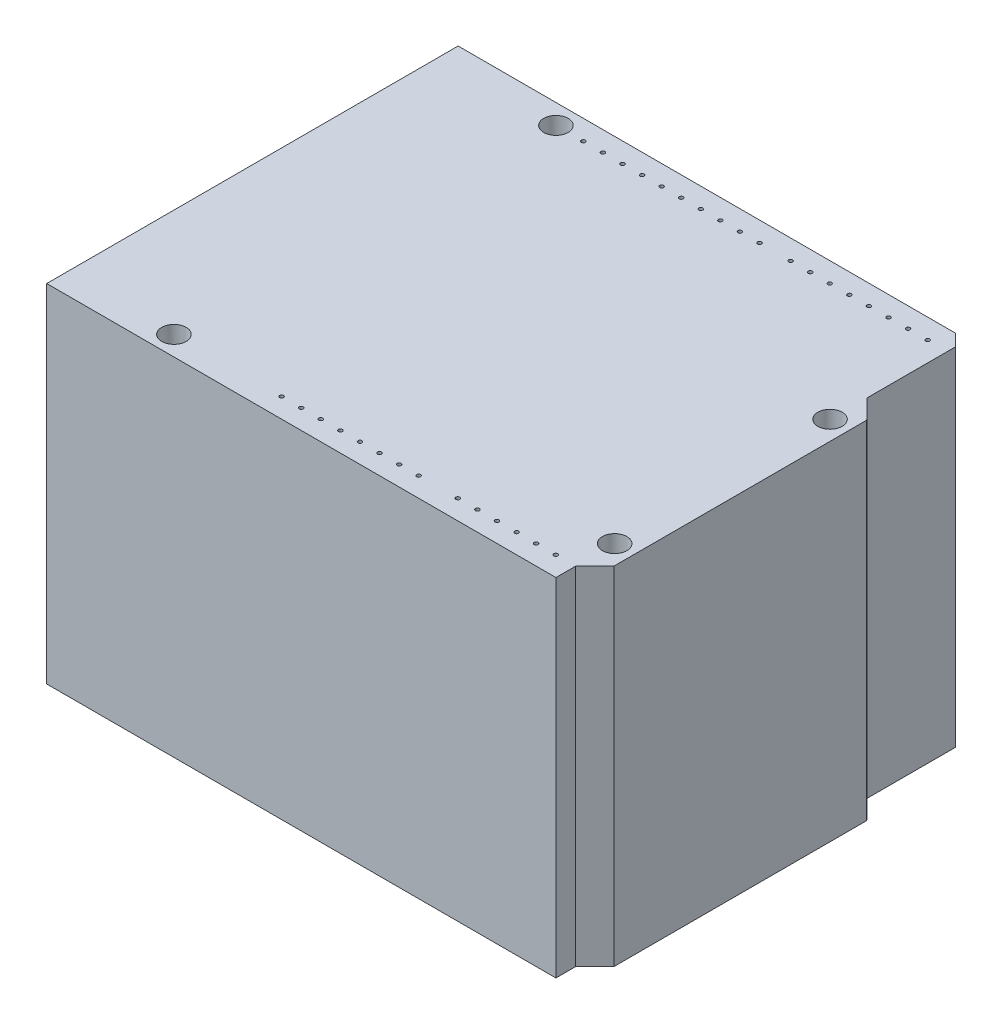
from build123d import *

# Parameters (mm, degrees)
SALIENTE_EXTRUIR1_DEPTH = 45
DRILLS_R                = 1.5875
CORTAR_EXTRUIR1_DEPTH   = 98.843568471
PINOUT_R                = 0.254
CORTAR_EXTRUIR2_DEPTH   = 98.843568471


with BuildPart() as part:
    # Board → Saliente-Extruir1 (new body)
    with BuildSketch(Plane(origin=(0, 0, 0), x_dir=(1, 0, 0), z_dir=(0, 1, 0))):
        Polygon((68.55, 37.846), (68.55, 5.08), (66.07, 2.54), (66.07, 0), (0, 0), (0, 53.378473106), (64.505207648, 53.378473106), (66.07, 51.813680753), (66.07, 40.386), align=None)
    extrude(amount=SALIENTE_EXTRUIR1_DEPTH)

    # Drills → Cortar-Extruir1 (cut, through all)
    with BuildSketch(Plane(origin=(0, 0, 0), x_dir=(1, 0, 0), z_dir=(0, 1, 0))):
        with Locations(Location((15.27, 50.8, 0), (0, 0, 90))):
            Circle(DRILLS_R)
        with Locations(Location((66.07, 35.56, 0), (0, 0, 90))):
            Circle(DRILLS_R)
        with Locations(Location((66.07, 7.62, 0), (0, 0, 90))):
            Circle(DRILLS_R)
        with Locations(Location((13.970000009, 2.54, 0), (0, 0, 90))):
            Circle(DRILLS_R)
    extrude(amount=CORTAR_EXTRUIR1_DEPTH, mode=Mode.SUBTRACT)

    # Pinout → Cortar-Extruir2 (cut, through all)
    with BuildSketch(Plane(origin=(0, 0, 0), x_dir=(1, 0, 0), z_dir=(0, 1, 0))):
        with Locations(Location((63.50000008, 2.54, 0), (0, 0, 270))):
            Circle(PINOUT_R)
        with Locations(Location((60.96000008, 2.54, 0), (0, 0, 270))):
            Circle(PINOUT_R)
        with Locations(Location((58.42000008, 2.54, 0), (0, 0, 270))):
            Circle(PINOUT_R)
        with Locations(Location((55.88000008, 2.54, 0), (0, 0, 270))):
            Circle(PINOUT_R)
        with Locations(Location((53.34000008, 2.54, 0), (0, 0, 270))):
            Circle(PINOUT_R)
        with Locations(Location((50.80000008, 2.54, 0), (0, 0, 270))):
            Circle(PINOUT_R)
        with Locations(Location((45.72000008, 2.54, 0), (0, 0, 270))):
            Circle(PINOUT_R)
        with Locations(Location((43.18000008, 2.54, 0), (0, 0, 270))):
            Circle(PINOUT_R)
        with Locations(Location((40.64000008, 2.54, 0), (0, 0, 270))):
            Circle(PINOUT_R)
        with Locations(Location((38.10000008, 2.54, 0), (0, 0, 270))):
            Circle(PINOUT_R)
        with Locations(Location((35.56000008, 2.54, 0), (0, 0, 270))):
            Circle(PINOUT_R)
        with Locations(Location((33.02000008, 2.54, 0), (0, 0, 270))):
            Circle(PINOUT_R)
        with Locations(Location((30.48000008, 2.54, 0), (0, 0, 270))):
            Circle(PINOUT_R)
        with Locations(Location((27.94000008, 2.54, 0), (0, 0, 270))):
            Circle(PINOUT_R)
        with Locations(Location((63.50000008, 50.8, 0), (0, 0, 270))):
            Circle(PINOUT_R)
        with Locations(Location((60.96000008, 50.8, 0), (0, 0, 270))):
            Circle(PINOUT_R)
        with Locations(Location((58.42000008, 50.8, 0), (0, 0, 270))):
            Circle(PINOUT_R)
        with Locations(Location((55.88000008, 50.8, 0), (0, 0, 270))):
            Circle(PINOUT_R)
        with Locations(Location((53.34000008, 50.8, 0), (0, 0, 270))):
            Circle(PINOUT_R)
        with Locations(Location((50.80000008, 50.8, 0), (0, 0, 270))):
            Circle(PINOUT_R)
        with Locations(Location((48.26000008, 50.8, 0), (0, 0, 270))):
            Circle(PINOUT_R)
        with Locations(Location((45.72000008, 50.8, 0), (0, 0, 270))):
            Circle(PINOUT_R)
        with Locations(Location((41.68600002, 50.8, 0), (0, 0, 270))):
            Circle(PINOUT_R)
        with Locations(Location((39.14600002, 50.8, 0), (0, 0, 270))):
            Circle(PINOUT_R)
        with Locations(Location((36.60600002, 50.8, 0), (0, 0, 270))):
            Circle(PINOUT_R)
        with Locations(Location((34.06600002, 50.8, 0), (0, 0, 270))):
            Circle(PINOUT_R)
        with Locations(Location((31.52600002, 50.8, 0), (0, 0, 270))):
            Circle(PINOUT_R)
        with Locations(Location((28.98600002, 50.8, 0), (0, 0, 270))):
            Circle(PINOUT_R)
        with Locations(Location((26.44600002, 50.8, 0), (0, 0, 270))):
            Circle(PINOUT_R)
        with Locations(Location((23.90600002, 50.8, 0), (0, 0, 270))):
            Circle(PINOUT_R)
        with Locations(Location((21.36600002, 50.8, 0), (0, 0, 270))):
            Circle(PINOUT_R)
        with Locations(Location((18.82600002, 50.8, 0), (0, 0, 270))):
            Circle(PINOUT_R)
    extrude(amount=CORTAR_EXTRUIR2_DEPTH, mode=Mode.SUBTRACT)


solid = part.part
